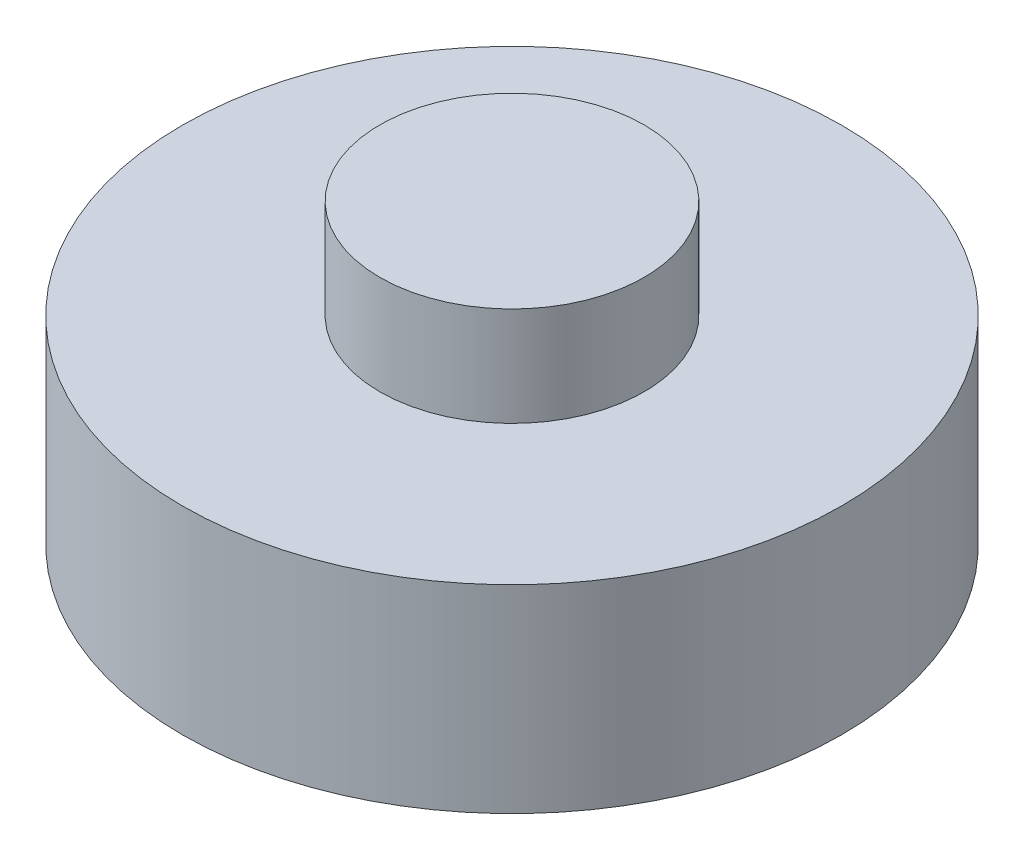
from build123d import *

# Parameters (mm, degrees)
SKETCH1_R           = 49.9
BOSS_EXTRUDE1_DEPTH = 30
SKETCH2_R           = 20
BOSS_EXTRUDE2_DEPTH = 15


with BuildPart() as part:
    # Sketch1 → Boss-Extrude1 (new body)
    with BuildSketch(Plane(origin=(0, 0, 0), x_dir=(1, 0, 0), z_dir=(0, 1, 0))):
        with Locations(Location((0, 0, 0), (0, 0, 270))):
            Circle(SKETCH1_R)
    extrude(amount=BOSS_EXTRUDE1_DEPTH)

    # Sketch2 → Boss-Extrude2 (add)
    with BuildSketch(Plane(origin=(0, 30, 0), x_dir=(1, 0, 0), z_dir=(0, 1, 0))):
        with Locations(Location((0, 0, 0), (0, 0, 270))):
            Circle(SKETCH2_R)
    extrude(amount=BOSS_EXTRUDE2_DEPTH)


solid = part.part
